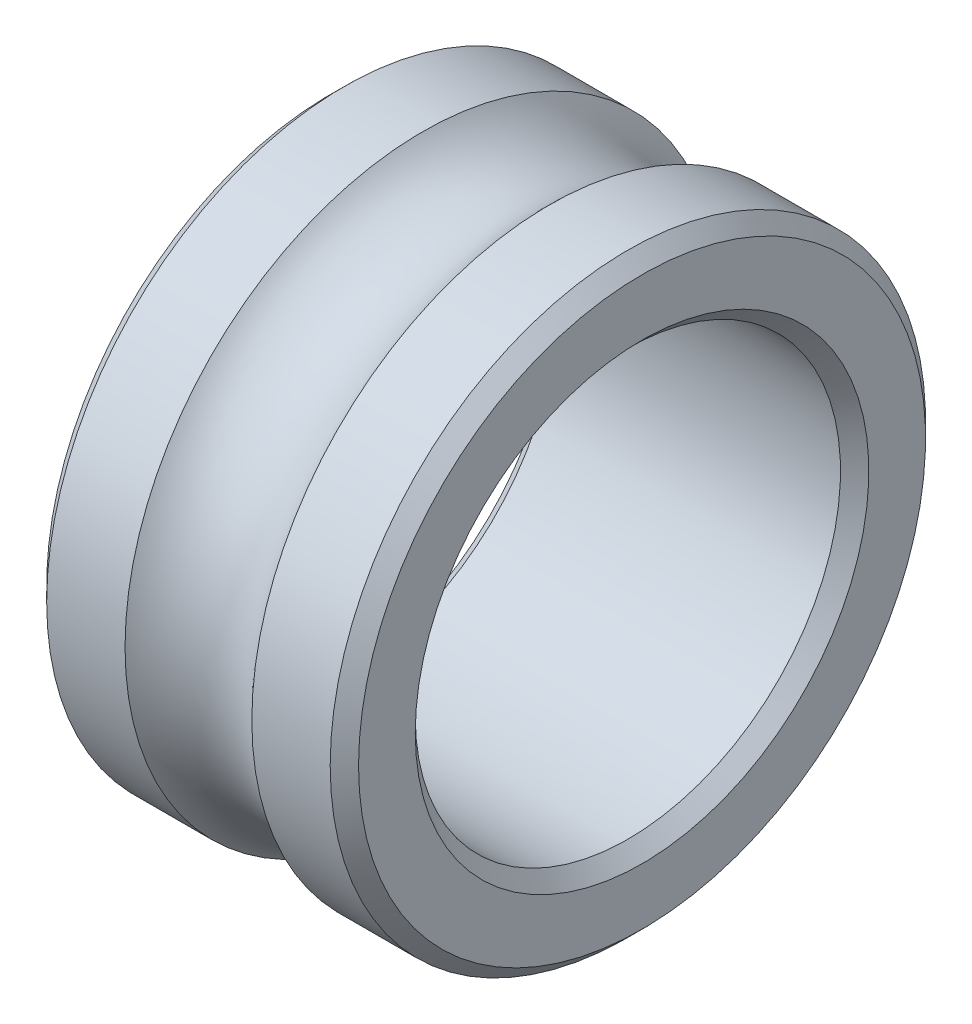
from build123d import *

# Parameters (mm, degrees)
CHAMFER1_SIZE = 0.5


with BuildPart() as part:
    # Sketch1 → Revolve1 (revolve)
    with BuildSketch(Plane.XY, mode=Mode.PRIVATE) as revolve1_sk:
        with BuildLine():
            Line((5.5, 10.5), (2.236067977, 10.5))
            ThreePointArc((2.236067977, 10.5), (0, 9.5), (-2.236067977, 10.5))
            Line((-2.236067977, 10.5), (-5.5, 10.5))
            Line((-5.5, 10.5), (-5.5, 7.5))
            Line((-5.5, 7.5), (5.5, 7.5))
            Line((5.5, 7.5), (5.5, 10.5))
        make_face()
    revolve(revolve1_sk.sketch.rotate(Axis((-28.291139241, 0, 0), (1, 0, 0)), 90), axis=Axis((-28.291139241, 0, 0), (1, 0, 0)))

    # Chamfer1
    chamfer1_edges = [part.edges().sort_by_distance(p)[0] for p in [
        (-5.5, 0, -10.5),
        (5.5, 0, -10.5),
        (5.5, 0, -7.5),
        (-5.5, 0, -7.5),
    ]]
    chamfer(chamfer1_edges, length=CHAMFER1_SIZE)


solid = part.part
